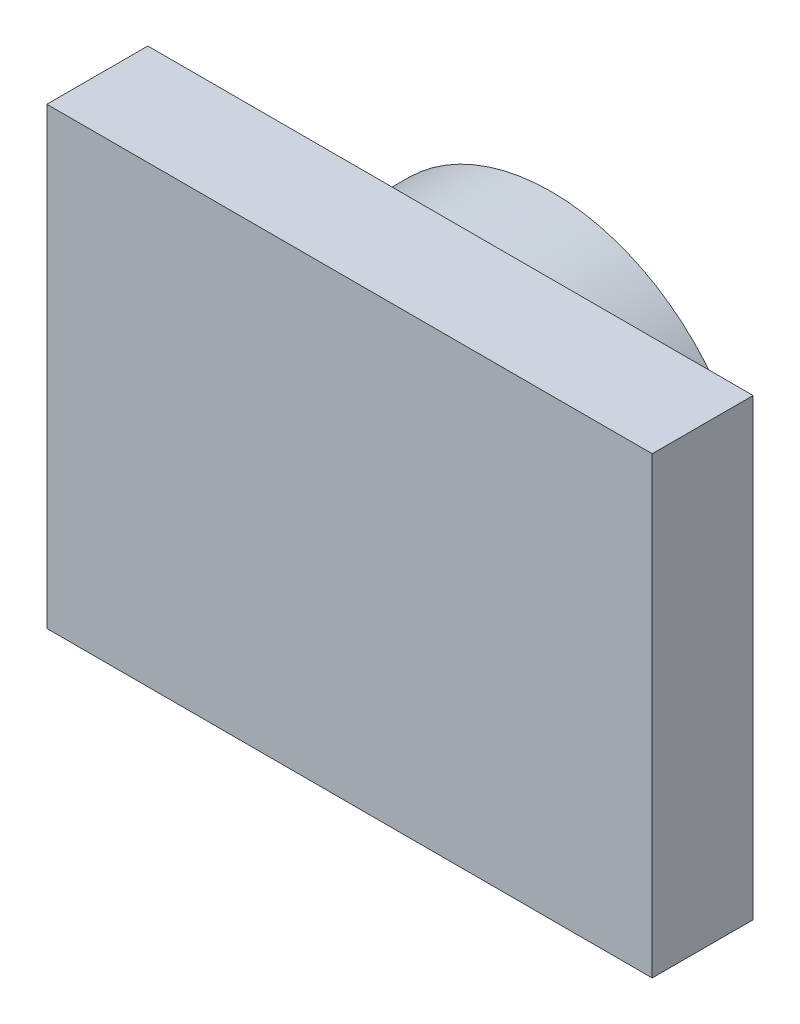
from build123d import *

# Parameters (mm, degrees)
CROQUIS1_R              = 20
SALIENTE_EXTRUIR1_DEPTH = 10
CROQUIS2_W              = 60
CROQUIS2_H              = 45
SALIENTE_EXTRUIR2_DEPTH = 10


with BuildPart() as part:
    # Croquis1 → Saliente-Extruir1 (new body)
    with BuildSketch(Plane.XY):
        Circle(CROQUIS1_R)
    extrude(amount=SALIENTE_EXTRUIR1_DEPTH)

    # Croquis2 → Saliente-Extruir2 (add)
    with BuildSketch(Plane.XY.offset(10)):
        Rectangle(CROQUIS2_W, CROQUIS2_H)
    extrude(amount=SALIENTE_EXTRUIR2_DEPTH)


solid = part.part
